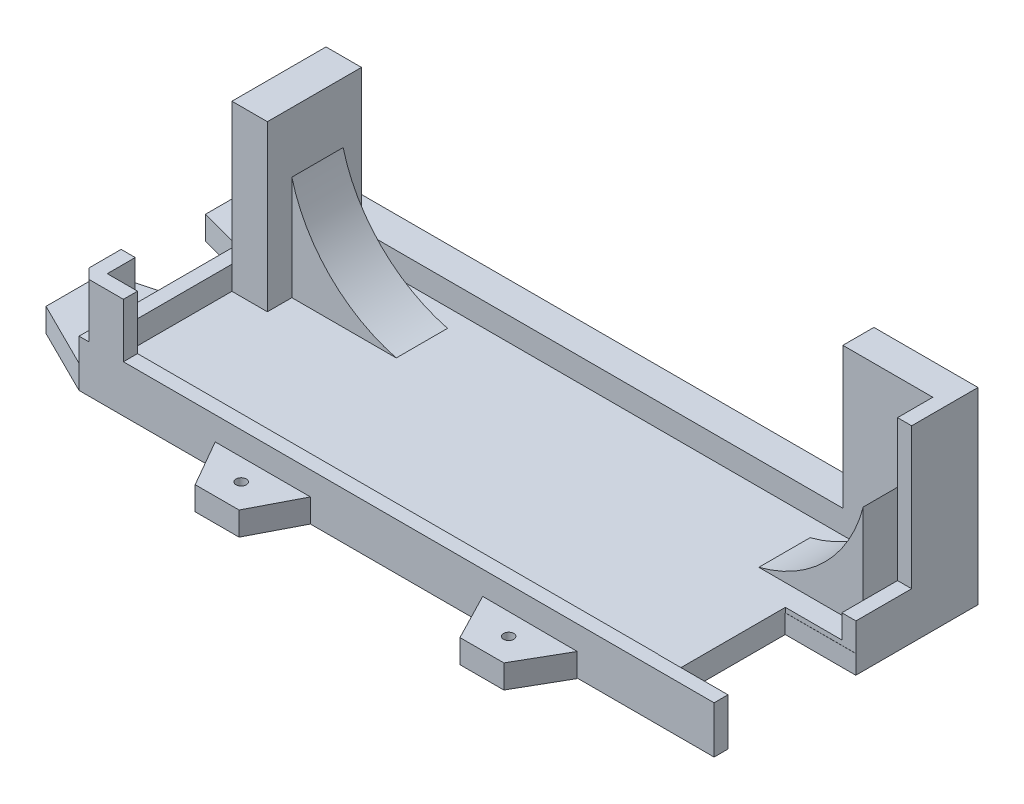
from build123d import *

# Parameters (mm, degrees)
SKETCH3_W            = 270
SKETCH3_H            = 112.2
BOSS_EXTRUDE1_DEPTH  = 20
CUT_EXTRUDE1_START   = 10
SKETCH2_W            = 258
SKETCH2_H            = 93
CUT_EXTRUDE1_DEPTH   = 30
SKETCH5_W            = 27.15
SKETCH5_H            = 8
CUT_EXTRUDE2_DEPTH   = 30
SKETCH7_W            = 27.2
SKETCH7_H            = 12
CUT_EXTRUDE3_DEPTH   = 30
BOSS_EXTRUDE6_DEPTH  = 23
BOSS_EXTRUDE7_DEPTH  = 10
SKETCH27_R           = 2.1825
CUT_EXTRUDE4_DEPTH   = 5
BOSS_EXTRUDE10_START = 7.8
BOSS_EXTRUDE10_DEPTH = 21.8
SKETCH34_W           = 15.08
SKETCH34_H           = 40
BOSS_EXTRUDE11_DEPTH = 70
BOSS_EXTRUDE12_DEPTH = 60


with BuildPart() as part:
    # Sketch3 → Boss-Extrude1 (new body)
    with BuildSketch(Plane(origin=(0, 0, 0), x_dir=(1, 0, 0), z_dir=(0, 1, 0))):
        with Locations((0, 23)):
            Rectangle(SKETCH3_W, SKETCH3_H)
    extrude(amount=BOSS_EXTRUDE1_DEPTH)

    # Sketch2 → Cut-Extrude1 (cut)
    with BuildSketch(Plane(origin=(0, 0, 0), x_dir=(1, 0, 0), z_dir=(0, 1, 0)).offset(CUT_EXTRUDE1_START)):
        with Locations((0, 19.4)):
            Rectangle(SKETCH2_W, SKETCH2_H)
    extrude(amount=CUT_EXTRUDE1_DEPTH, mode=Mode.SUBTRACT)

    # Sketch5 → Cut-Extrude2 (cut)
    with BuildSketch(Plane(origin=(135, 0, 0), x_dir=(0, 0, -1), z_dir=(1, 0, 0))):
        with Locations((13.575, 4)):
            Rectangle(SKETCH5_W, SKETCH5_H)
    cut_extrude2 = extrude(amount=-CUT_EXTRUDE2_DEPTH, mode=Mode.SUBTRACT)

    # Mirror1: Cut-Extrude2 across plane
    add(cut_extrude2.mirror(Plane.XY), mode=Mode.SUBTRACT)

    # Sketch7 → Cut-Extrude3 (cut)
    with BuildSketch(Plane(origin=(135, 0, 0), x_dir=(0, 0, -1), z_dir=(1, 0, 0))):
        with Locations((13.6, 14)):
            Rectangle(SKETCH7_W, SKETCH7_H)
    cut_extrude3 = extrude(amount=-CUT_EXTRUDE3_DEPTH, mode=Mode.SUBTRACT)

    # Mirror2: Cut-Extrude3 across plane
    add(cut_extrude3.mirror(Plane.XY), mode=Mode.SUBTRACT)

    # Sketch23 → Boss-Extrude6 (add)
    with BuildSketch(Plane(origin=(0, 20, 0), x_dir=(1, 0, 0), z_dir=(0, 1, 0))):
        Polygon((-135, -15.201290187), (-129, -15.201290187), (-129, -27.1), (-116.129520543, -27.1), (-116.129520543, -33.1), (-130.748790546, -33.1), (-135, -28.848790546), align=None)
    extrude(amount=BOSS_EXTRUDE6_DEPTH)

    # Sketch26 → Boss-Extrude7 (add)
    with BuildSketch(Plane(origin=(0, 0, 0), x_dir=(1, 0, 0), z_dir=(0, 1, 0))):
        Polygon((-135, 41.199092499), (-135, 79.1), (-163, 73.546424044), (-163, 48.655333625), align=None)
        Polygon((-135, 13.200907501), (-163, 5.744666375), (-163, -19.146424044), (-135, -33.1), align=None)
        Polygon((-77.113011714, -33.1), (-36.620106691, -33.1), (-46.95788024, -53.1), (-65.621461612, -53.1), align=None)
        Polygon((36.620106691, -33.1), (77.004264715, -33.289264282), (65.621461612, -53.1), (46.95788024, -53.1), align=None)
    extrude(amount=BOSS_EXTRUDE7_DEPTH)


with BuildPart() as boss_extrude7_piece_1:
    # of the separate pieces the step leaves, piece 1, a body of its own (boss_extrude7_pieces)
    add(part.part.solids().sort_by_distance((-135, 0, 33.1))[0])


with BuildPart() as boss_extrude7_piece_2:
    # of the separate pieces the step leaves, piece 2, a body of its own (boss_extrude7_pieces)
    add(part.part.solids().sort_by_distance((77.004264715, 0, 33.289264282))[0])


with BuildPart() as cut_extrude4_tool:
    # Sketch27 → Cut-Extrude4 (new, symmetric)
    with BuildSketch(Plane(origin=(0, 10, 0), x_dir=(1, 0, 0), z_dir=(0, 1, 0))):
        with Locations(Location((-56.866559202, -42.309979601, 0), (0, 0, 270))):
            Circle(SKETCH27_R)
        with Locations(Location((56.866559202, -42.309979601, 0), (0, 0, 270))):
            Circle(SKETCH27_R)
        with Locations(Location((-149.002974589, 60.14954625, 0), (0, 0, 270))):
            Circle(SKETCH27_R)
        with Locations(Location((-149.002974589, -9.94954625, 0), (0, 0, 270))):
            Circle(SKETCH27_R)
    extrude(amount=CUT_EXTRUDE4_DEPTH, both=True)


with BuildPart() as boss_extrude7_piece_1_1:
    add(boss_extrude7_piece_1.part)

    # Cut-Extrude4: cut by cut_extrude4_tool
    add(cut_extrude4_tool.part, mode=Mode.SUBTRACT)

    # Sketch32 → Boss-Extrude10 (add)
    with BuildSketch(Plane.XY.offset(-65.9).offset(BOSS_EXTRUDE10_START)):
        with BuildLine():
            Line((84.617950873, 10), (129, 10))
            Line((129, 10), (129, 54.379725349))
            ThreePointArc((129, 54.379725349), (112.839595195, 26.158927146), (84.617950873, 10))
        make_face()
        with BuildLine():
            Line((-69.537950873, 10), (-113.92, 10))
            Line((-113.92, 10), (-113.92, 54.379725349))
            ThreePointArc((-113.92, 54.379725349), (-97.759595195, 26.158927146), (-69.537950873, 10))
        make_face()
    extrude(amount=BOSS_EXTRUDE10_DEPTH)

    # Sketch34 → Boss-Extrude11 (add)
    with BuildSketch(Plane(origin=(0, 10, 0), x_dir=(1, 0, 0), z_dir=(0, 1, 0))):
        with Locations((-121.46, 45.9)):
            Rectangle(SKETCH34_W, SKETCH34_H)
    extrude(amount=BOSS_EXTRUDE11_DEPTH)

    # Sketch36 → Boss-Extrude12 (add)
    with BuildSketch(Plane(origin=(0, 20, 0), x_dir=(1, 0, 0), z_dir=(0, 1, 0))):
        Polygon((135, 79.1), (135, 50.889116573), (129, 50.889116573), (129, 65.9), (90.745815543, 65.9), (90.745815543, 79.1), align=None)
    extrude(amount=BOSS_EXTRUDE12_DEPTH)


with BuildPart() as boss_extrude7_piece_2_1:
    add(boss_extrude7_piece_2.part)

    # Cut-Extrude4: cut by cut_extrude4_tool
    add(cut_extrude4_tool.part, mode=Mode.SUBTRACT)


solid = Compound([boss_extrude7_piece_1_1.part, boss_extrude7_piece_2_1.part])
